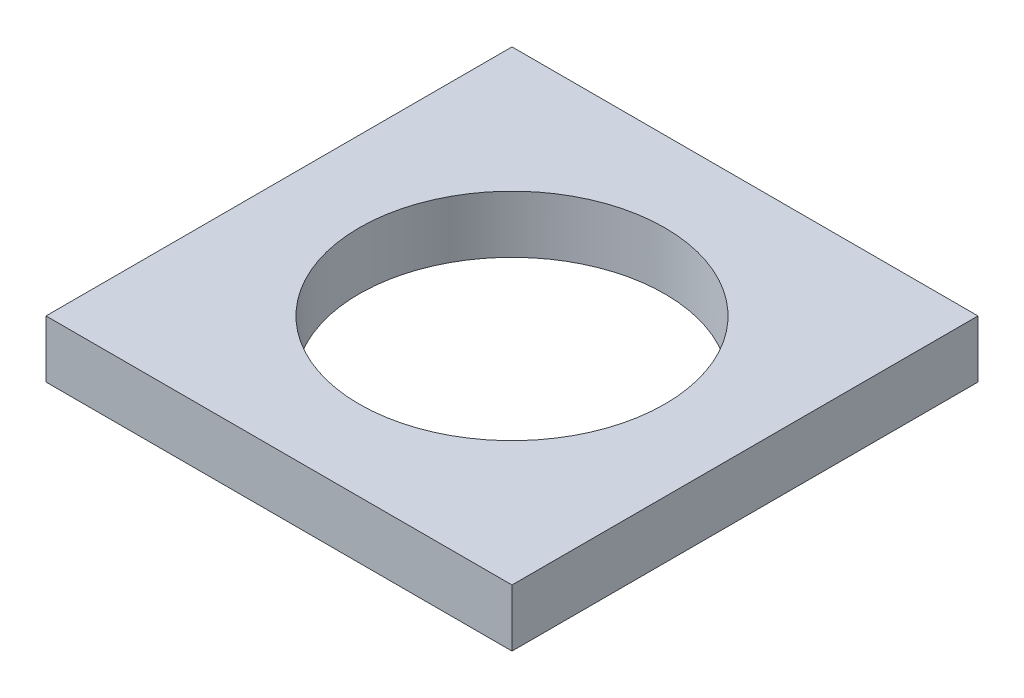
from build123d import *

# Parameters (mm, degrees)
SKETCH1_W             = 12.2
SKETCH1_H             = 12.2
SEAL_DEPTH            = 1.5
WATER_HOLE_DEPTH      = 9.756140702
WATER_HOLE_DEPTH_BACK = 9.756140702
SKETCH2_R             = 4


with BuildPart() as part:
    # Sketch1 → Seal (new body)
    with BuildSketch(Plane(origin=(0, 0, 0), x_dir=(1, 0, 0), z_dir=(0, 1, 0))):
        Rectangle(SKETCH1_W, SKETCH1_H)
    extrude(amount=SEAL_DEPTH)

    # Sketch2 → Water_Hole (cut, two sides: drawn at the far end of the back side and taken through both)
    with BuildSketch(Plane(origin=(0, 0, 0), x_dir=(1, 0, 0), z_dir=(0, 1, 0)).offset(-WATER_HOLE_DEPTH_BACK)):
        with Locations(Location((0, 0, 0), (0, 0, 270))):
            Circle(SKETCH2_R)
    extrude(amount=WATER_HOLE_DEPTH + WATER_HOLE_DEPTH_BACK, mode=Mode.SUBTRACT)


solid = part.part
